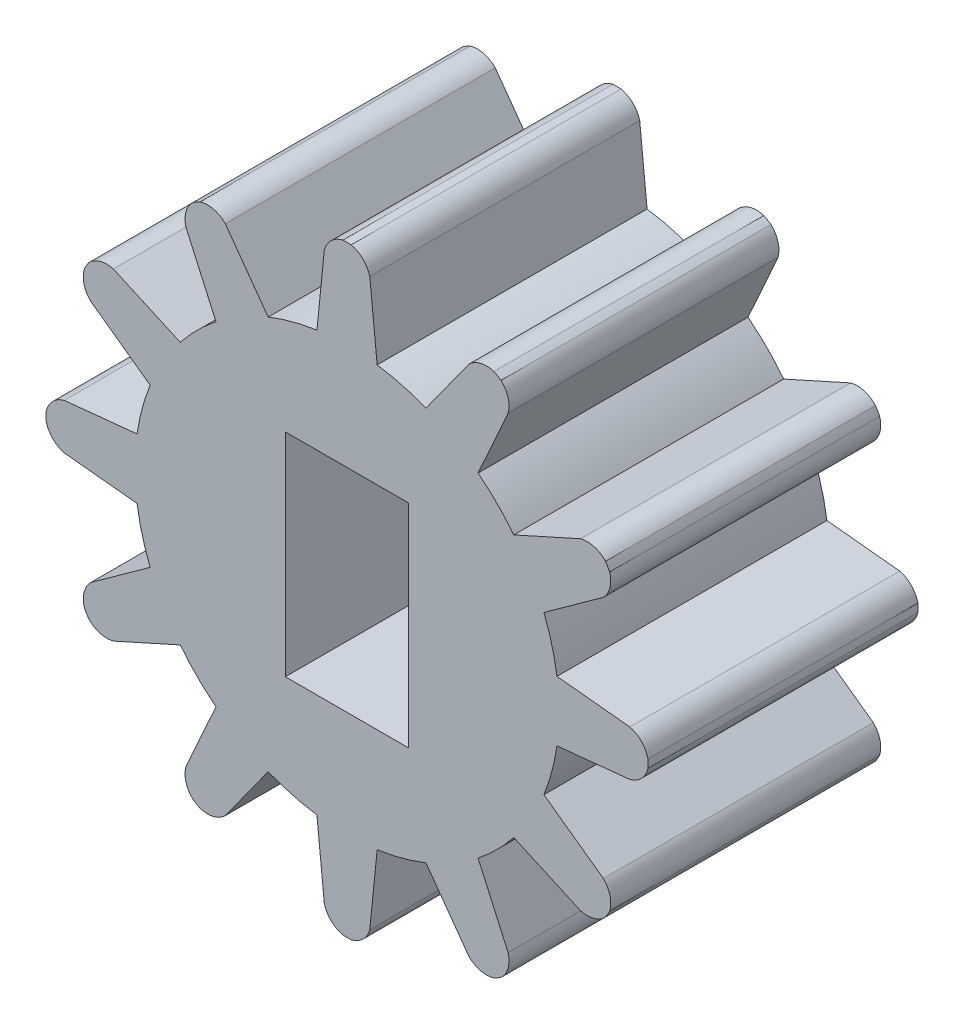
from build123d import *

# Parameters (mm, degrees)
SKETCH1_R           = 5.5
BOSS_EXTRUDE2_DEPTH = 7
SKETCH3_W           = 3.2
SKETCH3_H           = 5.5
CUT_EXTRUDE1_DEPTH  = 6
BOSS_EXTRUDE3_DEPTH = 7


with BuildPart() as part:
    # Sketch1 → Boss-Extrude2 (new body)
    with BuildSketch(Plane.XY.offset(20)):
        with Locations((0, 20.92523633)):
            Circle(SKETCH1_R)
    extrude(amount=BOSS_EXTRUDE2_DEPTH)

    # Sketch3 → Cut-Extrude1 (cut)
    with BuildSketch(Plane.XY.offset(28.5)):
        with Locations((0, 20.92523633)):
            Rectangle(SKETCH3_W, SKETCH3_H)
    extrude(amount=-CUT_EXTRUDE1_DEPTH, mode=Mode.SUBTRACT)

    # Sketch4 → Boss-Extrude3 (add)
    with BuildSketch(Plane.XY.offset(20)):
        with BuildLine():
            Line((-0.589624168, 28.259910336), (-0.780713641, 26.369544019))
            ThreePointArc((-0.780713641, 26.369544019), (0, 26.42523633), (0.780713641, 26.369544019))
            Line((0.780713641, 26.369544019), (0.589624168, 28.259910336))
            ThreePointArc((0.589624168, 28.259910336), (0.413456372, 28.561426906), (0.106677857, 28.728262986))
            ThreePointArc((0.106677857, 28.728262986), (0, 28.731092023), (-0.106677857, 28.728262986))
            ThreePointArc((-0.106677857, 28.728262986), (-0.413456372, 28.561426906), (-0.589624168, 28.259910336))
        make_face()
        with BuildLine():
            Line((4.177966512, 26.982438264), (3.39827169, 25.249788274))
            ThreePointArc((3.39827169, 25.249788274), (2.75, 25.688376051), (2.046035999, 26.030501915))
            Line((2.046035999, 26.030501915), (3.156707495, 27.572062432))
            ThreePointArc((3.156707495, 27.572062432), (3.460031567, 27.745099543), (3.809127593, 27.736194569))
            ThreePointArc((3.809127593, 27.736194569), (3.902927847, 27.685305659), (3.993899063, 27.629516712))
            ThreePointArc((3.993899063, 27.629516712), (4.176159009, 27.331643171), (4.177966512, 26.982438264))
        make_face()
        with BuildLine():
            Line((6.646826102, 24.081943825), (5.105265585, 22.971272329))
            ThreePointArc((5.105265585, 22.971272329), (4.763139721, 23.67523633), (4.324551944, 24.32350802))
            Line((4.324551944, 24.32350802), (6.057201934, 25.103202842))
            ThreePointArc((6.057201934, 25.103202842), (6.406406841, 25.101395339), (6.704280382, 24.919135393))
            ThreePointArc((6.704280382, 24.919135393), (6.760069329, 24.828164177), (6.810958239, 24.734363924))
            ThreePointArc((6.810958239, 24.734363924), (6.819863213, 24.385267897), (6.646826102, 24.081943825))
        make_face()
        with BuildLine():
            Line((7.334674006, 20.335612162), (5.444307689, 20.14452269))
            ThreePointArc((5.444307689, 20.14452269), (5.5, 20.92523633), (5.444307689, 21.705949971))
            Line((5.444307689, 21.705949971), (7.334674006, 21.514860499))
            ThreePointArc((7.334674006, 21.514860499), (7.636190576, 21.338692702), (7.803026656, 21.031914187))
            ThreePointArc((7.803026656, 21.031914187), (7.805855693, 20.92523633), (7.803026656, 20.818558473))
            ThreePointArc((7.803026656, 20.818558473), (7.636190576, 20.511779958), (7.334674006, 20.335612162))
        make_face()
        with BuildLine():
            Line((6.057201934, 16.747269818), (4.324551944, 17.52696464))
            ThreePointArc((4.324551944, 17.52696464), (4.763139721, 18.17523633), (5.105265585, 18.879200331))
            Line((5.105265585, 18.879200331), (6.646826102, 17.768528836))
            ThreePointArc((6.646826102, 17.768528836), (6.819863213, 17.465204763), (6.810958239, 17.116108737))
            ThreePointArc((6.810958239, 17.116108737), (6.760069329, 17.022308483), (6.704280382, 16.931337267))
            ThreePointArc((6.704280382, 16.931337267), (6.406406841, 16.749077321), (6.057201934, 16.747269818))
        make_face()
        with BuildLine():
            Line((3.156707495, 14.278410228), (2.046035999, 15.819970745))
            ThreePointArc((2.046035999, 15.819970745), (2.75, 16.162096609), (3.39827169, 16.600684386))
            Line((3.39827169, 16.600684386), (4.177966512, 14.868034396))
            ThreePointArc((4.177966512, 14.868034396), (4.176159009, 14.518829489), (3.993899063, 14.220955948))
            ThreePointArc((3.993899063, 14.220955948), (3.902927847, 14.165167001), (3.809127593, 14.114278091))
            ThreePointArc((3.809127593, 14.114278091), (3.460031567, 14.105373117), (3.156707495, 14.278410228))
        make_face()
        with BuildLine():
            Line((-0.589624168, 13.590562324), (-0.780713641, 15.480928641))
            ThreePointArc((-0.780713641, 15.480928641), (0, 15.42523633), (0.780713641, 15.480928641))
            Line((0.780713641, 15.480928641), (0.589624168, 13.590562324))
            ThreePointArc((0.589624168, 13.590562324), (0.413456372, 13.289045754), (0.106677857, 13.122209674))
            ThreePointArc((0.106677857, 13.122209674), (0, 13.119380637), (-0.106677857, 13.122209674))
            ThreePointArc((-0.106677857, 13.122209674), (-0.413456372, 13.289045754), (-0.589624168, 13.590562324))
        make_face()
        with BuildLine():
            Line((-4.177966512, 14.868034396), (-3.39827169, 16.600684386))
            ThreePointArc((-3.39827169, 16.600684386), (-2.75, 16.162096609), (-2.046035999, 15.819970745))
            Line((-2.046035999, 15.819970745), (-3.156707495, 14.278410228))
            ThreePointArc((-3.156707495, 14.278410228), (-3.460031567, 14.105373117), (-3.809127593, 14.114278091))
            ThreePointArc((-3.809127593, 14.114278091), (-3.902927847, 14.165167001), (-3.993899063, 14.220955948))
            ThreePointArc((-3.993899063, 14.220955948), (-4.176159009, 14.518829489), (-4.177966512, 14.868034396))
        make_face()
        with BuildLine():
            Line((-6.646826102, 17.768528836), (-5.105265585, 18.879200331))
            ThreePointArc((-5.105265585, 18.879200331), (-4.763139721, 18.17523633), (-4.324551944, 17.52696464))
            Line((-4.324551944, 17.52696464), (-6.057201934, 16.747269818))
            ThreePointArc((-6.057201934, 16.747269818), (-6.406406841, 16.749077321), (-6.704280382, 16.931337267))
            ThreePointArc((-6.704280382, 16.931337267), (-6.760069329, 17.022308483), (-6.810958239, 17.116108737))
            ThreePointArc((-6.810958239, 17.116108737), (-6.819863213, 17.465204763), (-6.646826102, 17.768528836))
        make_face()
        with BuildLine():
            Line((-7.334674006, 21.514860499), (-5.444307689, 21.705949971))
            ThreePointArc((-5.444307689, 21.705949971), (-5.5, 20.92523633), (-5.444307689, 20.14452269))
            Line((-5.444307689, 20.14452269), (-7.334674006, 20.335612162))
            ThreePointArc((-7.334674006, 20.335612162), (-7.636190576, 20.511779958), (-7.803026656, 20.818558473))
            ThreePointArc((-7.803026656, 20.818558473), (-7.805855693, 20.92523633), (-7.803026656, 21.031914187))
            ThreePointArc((-7.803026656, 21.031914187), (-7.636190576, 21.338692702), (-7.334674006, 21.514860499))
        make_face()
        with BuildLine():
            Line((-6.057201934, 25.103202842), (-4.324551944, 24.32350802))
            ThreePointArc((-4.324551944, 24.32350802), (-4.763139721, 23.67523633), (-5.105265585, 22.971272329))
            Line((-5.105265585, 22.971272329), (-6.646826102, 24.081943825))
            ThreePointArc((-6.646826102, 24.081943825), (-6.819863213, 24.385267897), (-6.810958239, 24.734363924))
            ThreePointArc((-6.810958239, 24.734363924), (-6.760069329, 24.828164177), (-6.704280382, 24.919135393))
            ThreePointArc((-6.704280382, 24.919135393), (-6.406406841, 25.101395339), (-6.057201934, 25.103202842))
        make_face()
        with BuildLine():
            Line((-3.156707495, 27.572062432), (-2.046035999, 26.030501915))
            ThreePointArc((-2.046035999, 26.030501915), (-2.75, 25.688376051), (-3.39827169, 25.249788274))
            Line((-3.39827169, 25.249788274), (-4.177966512, 26.982438264))
            ThreePointArc((-4.177966512, 26.982438264), (-4.176159009, 27.331643171), (-3.993899063, 27.629516712))
            ThreePointArc((-3.993899063, 27.629516712), (-3.902927847, 27.685305659), (-3.809127593, 27.736194569))
            ThreePointArc((-3.809127593, 27.736194569), (-3.460031567, 27.745099543), (-3.156707495, 27.572062432))
        make_face()
    extrude(amount=BOSS_EXTRUDE3_DEPTH)


solid = part.part
